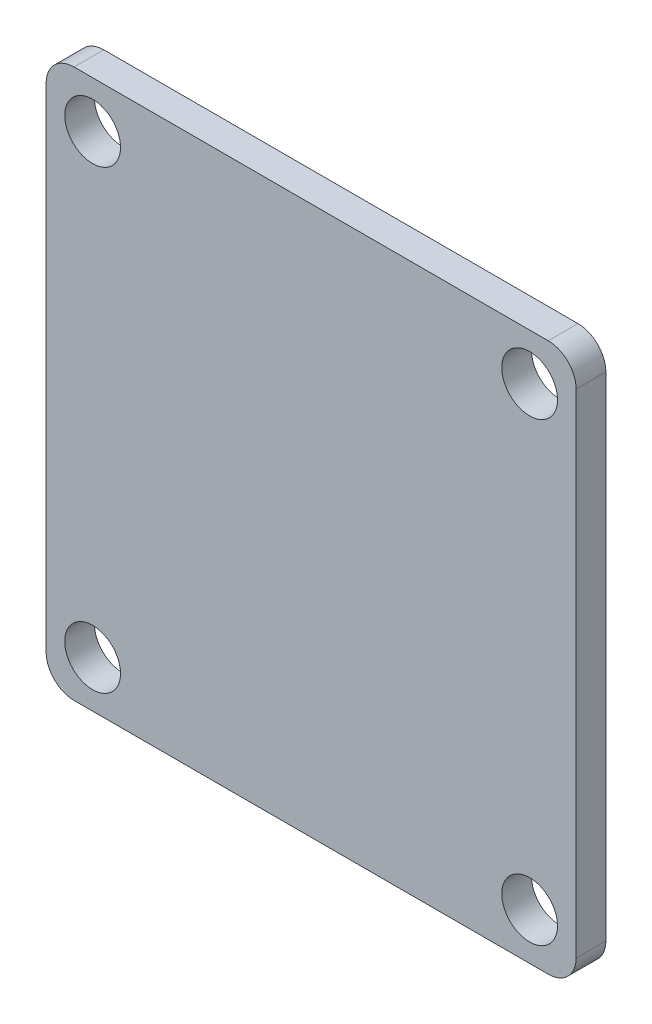
from build123d import *

# Parameters (mm, degrees)
SKETCH_1_R      = 1.5
EXTRUDE_1_DEPTH = 1.6
FILLET_1_R      = 1.5


with BuildPart() as part:
    # 草图1 → 凸台-拉伸1 (new body)
    with BuildSketch(Plane.XY):
        Polygon((0, 0), (28.5, 0), (28.5, 29.5), (2.5, 29.5), (0, 29.5), align=None)
        with Locations((2.5, 27)):
            Circle(SKETCH_1_R, mode=Mode.SUBTRACT)
        with Locations((26, 27)):
            Circle(SKETCH_1_R, mode=Mode.SUBTRACT)
        with Locations((26, 2.5)):
            Circle(SKETCH_1_R, mode=Mode.SUBTRACT)
        with Locations((2.5, 2.5)):
            Circle(SKETCH_1_R, mode=Mode.SUBTRACT)
    extrude(amount=EXTRUDE_1_DEPTH)

    # 圆角1
    fillet_1_edges = [part.edges().sort_by_distance(p)[0] for p in [
        (0, 29.5, 0.8),
        (28.5, 29.5, 0.8),
        (28.5, 0, 0.8),
        (0, 0, 0.8),
    ]]
    fillet(fillet_1_edges, radius=FILLET_1_R)


solid = part.part
